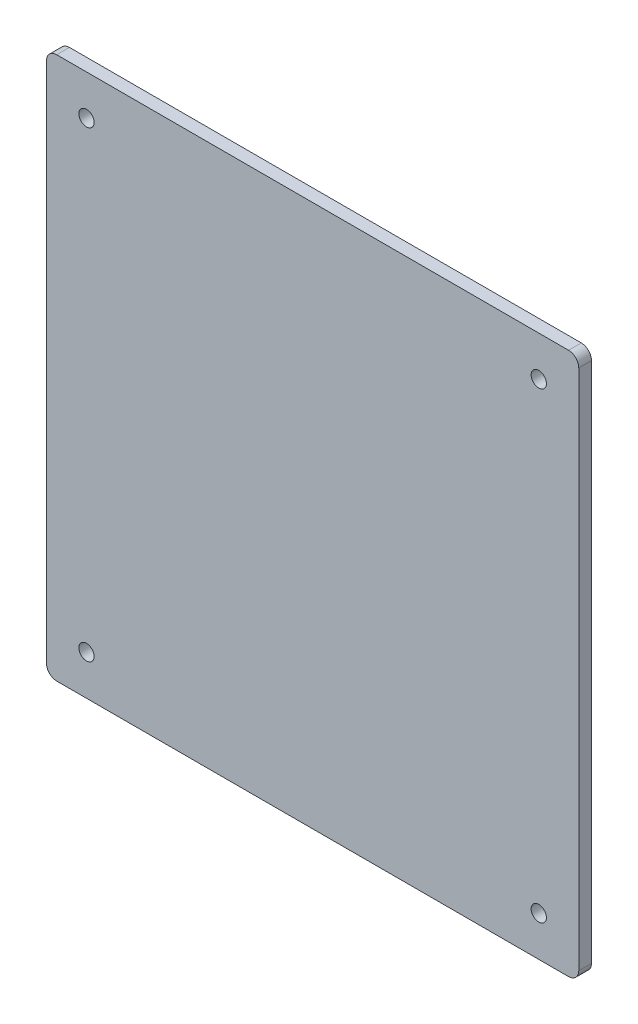
from build123d import *

# Parameters (mm, degrees)
SKETCH1_W           = 132.715
SKETCH1_H           = 135.255
BOSS_EXTRUDE1_DEPTH = 3.175
SKETCH4_R           = 1.905
CUT_EXTRUDE1_DEPTH  = 3.175
FILLET1_R           = 2.54


with BuildPart() as part:
    # Sketch1 → Boss-Extrude1 (new body)
    with BuildSketch(Plane.XY):
        with Locations((66.3575, 67.6275)):
            Rectangle(SKETCH1_W, SKETCH1_H)
    extrude(amount=BOSS_EXTRUDE1_DEPTH)

    # Sketch4 → Cut-Extrude1 (cut)
    with BuildSketch(Plane.XY.offset(3.175)):
        with Locations((9.9695, 125.2855)):
            Circle(SKETCH4_R)
        with Locations((122.7455, 9.9695)):
            Circle(SKETCH4_R)
        with Locations((9.9695, 9.9695)):
            Circle(SKETCH4_R)
        with Locations((122.7455, 125.2855)):
            Circle(SKETCH4_R)
    extrude(amount=-CUT_EXTRUDE1_DEPTH, mode=Mode.SUBTRACT)

    # Fillet1
    fillet1_edges = [part.edges().sort_by_distance(p)[0] for p in [
        (0, 135.255, 1.5875),
        (132.715, 135.255, 1.5875),
        (132.715, 0, 1.5875),
        (0, 0, 1.5875),
    ]]
    fillet(fillet1_edges, radius=FILLET1_R)


solid = part.part
